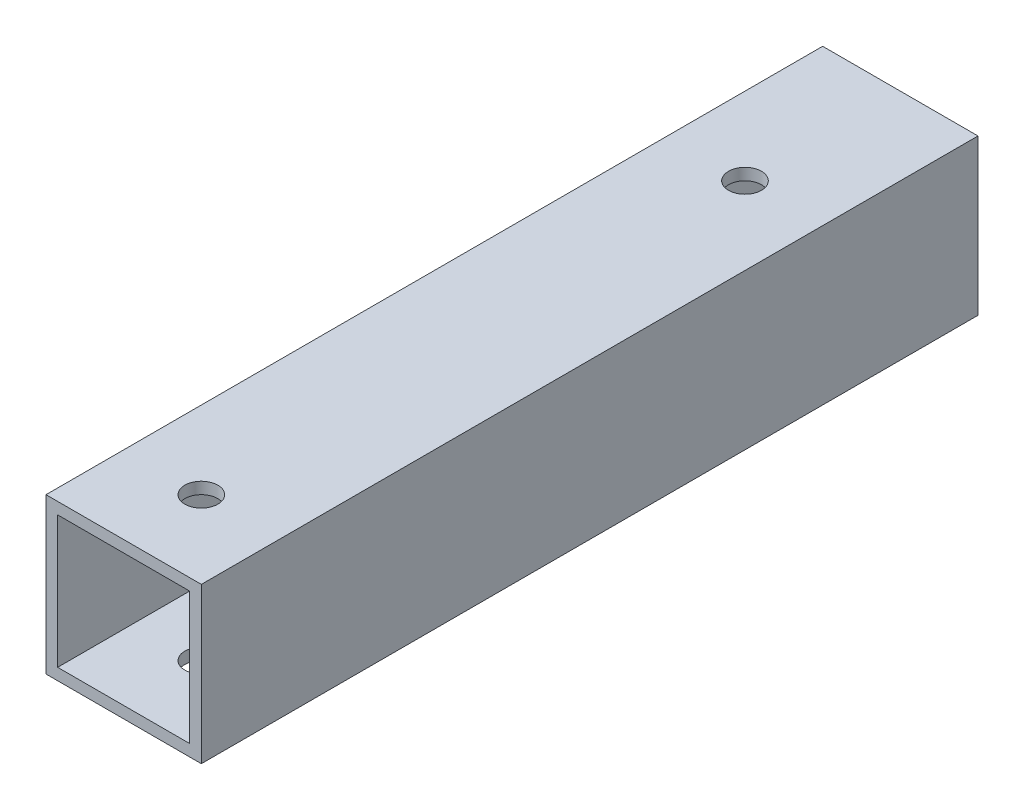
from build123d import *

# Parameters (mm, degrees)
SKETCH1_W           = 20
SKETCH1_H           = 20
SKETCH1_W_2         = 17
SKETCH1_H_2         = 17
BOSS_EXTRUDE1_DEPTH = 100
SKETCH2_R           = 2.125
CUT_EXTRUDE1_DEPTH  = 103.46950766


with BuildPart() as part:
    # Sketch1 → Boss-Extrude1 (new body)
    with BuildSketch(Plane.XY):
        Rectangle(SKETCH1_W, SKETCH1_H)
        Rectangle(SKETCH1_W_2, SKETCH1_H_2, mode=Mode.SUBTRACT)
    extrude(amount=-BOSS_EXTRUDE1_DEPTH)

    # Sketch2 → Cut-Extrude1 (cut, through all)
    with BuildSketch(Plane(origin=(0, 10, 0), x_dir=(1, 0, 0), z_dir=(0, 1, 0))):
        with Locations(Location((0, 10, 0), (0, 0, 270))):
            Circle(SKETCH2_R)
        with Locations(Location((0, 80, 0), (0, 0, 270))):
            Circle(SKETCH2_R)
        with Locations((0, 150)):
            Circle(SKETCH2_R)
    extrude(amount=-CUT_EXTRUDE1_DEPTH, mode=Mode.SUBTRACT)


solid = part.part
